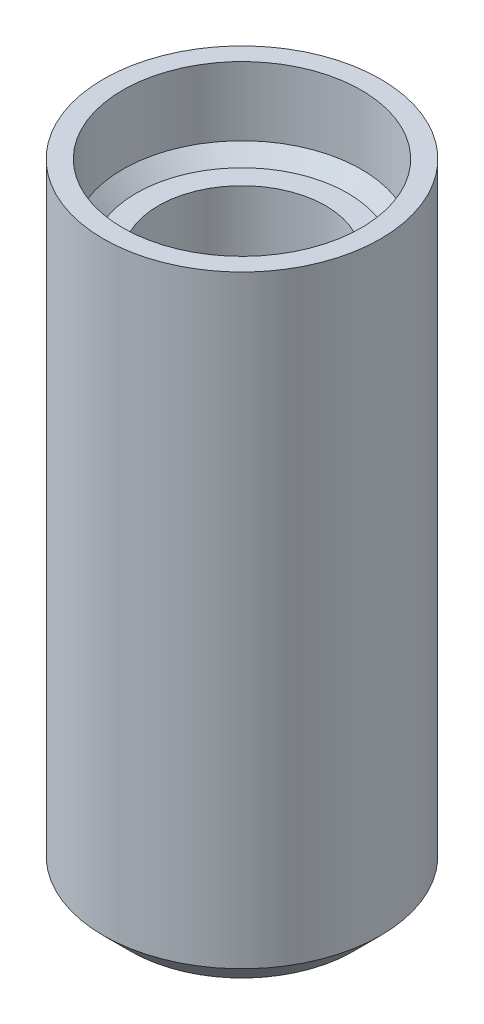
from build123d import *

# Parameters (mm, degrees)
SKETCH1_R           = 5.05
BOSS_EXTRUDE1_DEPTH = 20
SKETCH2_R           = 5.05
BOSS_EXTRUDE2_DEPTH = 2
SKETCH4_R           = 5.05
SKETCH4_R_2         = 4.35
BOSS_EXTRUDE3_DEPTH = 3
CHAMFER1_SIZE       = 1
CHAMFER2_SIZE       = 0.5
CUT_EXTRUDE1_DEPTH  = 0.4
BOSS_EXTRUDE4_DEPTH = 0.4


with BuildPart() as part:
    # Sketch1 → Boss-Extrude1 (new body)
    with BuildSketch(Plane(origin=(0, 0, 0), x_dir=(1, 0, 0), z_dir=(0, 1, 0))):
        Circle(SKETCH1_R)
        with BuildLine():
            Line((2.565151068, -1.65), (-2.565151068, -1.65))
            ThreePointArc((-2.565151068, -1.65), (0, 3.05), (2.565151068, -1.65))
        make_face(mode=Mode.SUBTRACT)
    extrude(amount=BOSS_EXTRUDE1_DEPTH)

    # Sketch2 → Boss-Extrude2 (add)
    with BuildSketch(Plane.XZ):
        Circle(SKETCH2_R)
    extrude(amount=-BOSS_EXTRUDE2_DEPTH)

    # Sketch4 → Boss-Extrude3 (add)
    with BuildSketch(Plane(origin=(0, 20, 0), x_dir=(1, 0, 0), z_dir=(0, 1, 0))):
        Circle(SKETCH4_R)
        Circle(SKETCH4_R_2, mode=Mode.SUBTRACT)
    extrude(amount=BOSS_EXTRUDE3_DEPTH)

    # Chamfer1
    chamfer1_edges = [part.edges().sort_by_distance(p)[0] for p in [
        (-5.05, 0, 0),
    ]]
    chamfer(chamfer1_edges, length=CHAMFER1_SIZE)

    # Chamfer2
    chamfer2_edges = [part.edges().sort_by_distance(p)[0] for p in [
        (-4.35, 20, 0),
    ]]
    chamfer(chamfer2_edges, length=CHAMFER2_SIZE)

    # Sketch5 → Cut-Extrude1 (cut)
    with BuildSketch(Plane.XZ):
        with BuildLine():
            add(Edge.make_bspline(
                [(1.567944017, 0.192921702), (1.567103463, 0.108565787), (1.565463932, -0.055973519), (1.549247691, -0.296621434), (1.522305793, -0.524534963), (1.486045945, -0.739816248), (1.43789322, -0.94151744), (1.374732908, -1.128195766), (1.298972887, -1.299878577), (1.210234813, -1.45621372), (1.106200607, -1.595338144), (0.989027334, -1.718882792), (0.85541095, -1.82326619), (0.707974056, -1.911459997), (0.544618259, -1.980846605), (0.364036396, -2.029758899), (0.166581818, -2.058442163), (0.029096593, -2.062104092), (-0.0419985, -2.063997715)],
                knots=[0, 0, 0, 0, 1.280142505, 2.496964928, 3.658445283, 4.762089533, 5.808699902, 6.802158264, 7.748814871, 8.653008089, 9.524146816, 10.379274413, 11.229404425, 12.089188086, 12.979964829, 13.913938538, 14.921275101, 16, 16, 16, 16], degree=3))
            add(Edge.make_bspline(
                [(-0.0419985, -2.063997715), (-0.114085658, -2.062061431), (-0.25217864, -2.05835221), (-0.449985974, -2.030813074), (-0.628118332, -1.983161468), (-0.787614595, -1.91659627), (-0.929750651, -1.832021476), (-1.054014515, -1.728205005), (-1.166223856, -1.610806373), (-1.259802448, -1.473792655), (-1.340149019, -1.321620028), (-1.406392893, -1.153626181), (-1.462209271, -0.970619118), (-1.501652878, -0.771428752), (-1.530893692, -0.557930049), (-1.552900083, -0.331105069), (-1.566011318, -0.090558156), (-1.567288008, 0.074242538), (-1.567944017, 0.158922916)],
                knots=[0, 0, 0, 0, 1.116564975, 2.138935591, 3.085931557, 3.965362537, 4.808430945, 5.637530691, 6.466775146, 7.316224023, 8.198621357, 9.127780993, 10.109559384, 11.158728965, 12.269463774, 13.447127443, 14.688244517, 16, 16, 16, 16], degree=3))
            add(Edge.make_bspline(
                [(-1.567944017, 0.158922916), (-1.56727094, 0.242959484), (-1.565958022, 0.406883046), (-1.547398036, 0.646654941), (-1.523007328, 0.874561982), (-1.484863664, 1.090015475), (-1.435637119, 1.292183379), (-1.373223381, 1.47955795), (-1.296737874, 1.650978747), (-1.207898153, 1.807115713), (-1.104587297, 1.947471726), (-0.98597514, 2.070365378), (-0.85247465, 2.175171039), (-0.704955811, 2.263283651), (-0.541625887, 2.332713568), (-0.361663301, 2.381358039), (-0.165271392, 2.41038651), (-0.028768775, 2.413979575), (0.0419985, 2.415842333)],
                knots=[0, 0, 0, 0, 1.275935792, 2.488868156, 3.650539398, 4.755790181, 5.809222936, 6.808140458, 7.750805295, 8.655602092, 9.531384403, 10.390594486, 11.241291987, 12.101649582, 12.993020947, 13.927618113, 14.925611662, 16, 16, 16, 16], degree=3))
            add(Edge.make_bspline(
                [(0.0419985, 2.415842333), (0.114116742, 2.414477102), (0.25266071, 2.411854403), (0.450369145, 2.381996557), (0.629787664, 2.336446676), (0.789415008, 2.268229736), (0.932246599, 2.183738709), (1.058666183, 2.081763133), (1.168735568, 1.962207144), (1.262973651, 1.825777095), (1.342954906, 1.673381215), (1.409963879, 1.505846105), (1.462541112, 1.32206188), (1.502782179, 1.123329255), (1.53216605, 0.909819278), (1.552535707, 0.682887301), (1.56611107, 0.442411219), (1.567321867, 0.277604947), (1.567944017, 0.192921702)],
                knots=[0, 0, 0, 0, 1.1154279, 2.142811628, 3.087698179, 3.973172265, 4.819981724, 5.64914424, 6.477969577, 7.326725871, 8.20840376, 9.136805822, 10.114848545, 11.163162705, 12.272991897, 13.449208879, 14.689314032, 16, 16, 16, 16], degree=3))
        make_face()
        with BuildLine():
            add(Edge.make_bspline(
                [(0.671976007, 0.147923309), (0.671761143, 0.197588193), (0.671345794, 0.293594494), (0.668808788, 0.433310834), (0.662146824, 0.563600217), (0.655896273, 0.685705832), (0.645645678, 0.799372722), (0.633701885, 0.905396977), (0.620258167, 1.00361133), (0.59765882, 1.119852962), (0.568329454, 1.249495616), (0.518981489, 1.383972273), (0.462364111, 1.495483821), (0.390154993, 1.580567825), (0.309089162, 1.64532417), (0.215543768, 1.685097937), (0.113546356, 1.708789827), (0.04214035, 1.710814416), (0.004999821, 1.711867468)],
                knots=[0, 0, 0, 0, 1.252656067, 2.421487074, 3.523945301, 4.542880805, 5.504947389, 6.401770782, 7.23401126, 8.00401156, 9.388497809, 10.580084833, 11.61067594, 12.523473101, 13.374357542, 14.202341007, 15.064980546, 16, 16, 16, 16], degree=3))
            add(Edge.make_bspline(
                [(0.004999821, 1.711867468), (-0.027108728, 1.710864236), (-0.088874053, 1.708934376), (-0.176959711, 1.69002996), (-0.257491776, 1.661921091), (-0.328204301, 1.61855612), (-0.391883608, 1.564673792), (-0.446390573, 1.497365618), (-0.495990703, 1.419828291), (-0.537600354, 1.33018996), (-0.57214802, 1.229054924), (-0.602202545, 1.116857945), (-0.625857574, 0.992508092), (-0.643327979, 0.856556385), (-0.656089252, 0.709073987), (-0.664593927, 0.549983621), (-0.670996715, 0.379299441), (-0.671642924, 0.261592524), (-0.671976007, 0.200921416)],
                knots=[0, 0, 0, 0, 0.830406459, 1.597403976, 2.323929485, 3.028688112, 3.73286484, 4.474568648, 5.262512747, 6.112128818, 7.026802286, 8.027809387, 9.118195914, 10.302553145, 11.576589742, 12.951469302, 14.428658737, 16, 16, 16, 16], degree=3))
            add(Edge.make_bspline(
                [(-0.671976007, 0.200921416), (-0.671693117, 0.127586061), (-0.671152907, -0.012455865), (-0.664379896, -0.212557586), (-0.652177413, -0.392922081), (-0.637219032, -0.554576304), (-0.615048197, -0.698390465), (-0.588432778, -0.826054575), (-0.556697247, -0.938463654), (-0.520366102, -1.036416278), (-0.477076212, -1.119805415), (-0.42795422, -1.18948205), (-0.373592358, -1.246955409), (-0.312417185, -1.290914567), (-0.244560244, -1.322168759), (-0.171328649, -1.343429439), (-0.092277059, -1.358574957), (-0.037409576, -1.359528904), (-0.008999679, -1.36002285)],
                knots=[0, 0, 0, 0, 1.85321902, 3.538925519, 5.058498589, 6.421342315, 7.640056482, 8.733733654, 9.714903156, 10.58939389, 11.369318339, 12.082176755, 12.737469836, 13.359260972, 13.973474606, 14.615698241, 15.283220796, 16, 16, 16, 16], degree=3))
            add(Edge.make_bspline(
                [(-0.008999679, -1.36002285), (0.032888173, -1.358409415), (0.112951194, -1.355325549), (0.225931657, -1.323402443), (0.324771216, -1.270609496), (0.408752445, -1.194316331), (0.480103664, -1.09828067), (0.536658452, -0.979922054), (0.582719263, -0.842729097), (0.619415786, -0.685336917), (0.645900941, -0.507435022), (0.661850394, -0.307994676), (0.670355892, -0.087146742), (0.671420014, 0.067251613), (0.671976007, 0.147923309)],
                knots=[0, 0, 0, 0, 0.812198358, 1.552408438, 2.25954763, 2.970620909, 3.738781613, 4.570097942, 5.508197261, 6.546623335, 7.706294858, 8.999891258, 10.432471252, 12, 12, 12, 12], degree=3))
        make_face(mode=Mode.SUBTRACT)
    extrude(amount=-CUT_EXTRUDE1_DEPTH, mode=Mode.SUBTRACT)


with BuildPart() as body_2:
    # Sketch5<2> → Boss-Extrude4 (new body)
    with BuildSketch(Plane.XZ):
        with BuildLine():
            add(Edge.make_bspline(
                [(1.567944017, 0.192921702), (1.567103463, 0.108565787), (1.565463932, -0.055973519), (1.549247691, -0.296621434), (1.522305793, -0.524534963), (1.486045945, -0.739816248), (1.43789322, -0.94151744), (1.374732908, -1.128195766), (1.298972887, -1.299878577), (1.210234813, -1.45621372), (1.106200607, -1.595338144), (0.989027334, -1.718882792), (0.85541095, -1.82326619), (0.707974056, -1.911459997), (0.544618259, -1.980846605), (0.364036396, -2.029758899), (0.166581818, -2.058442163), (0.029096593, -2.062104092), (-0.0419985, -2.063997715)],
                knots=[0, 0, 0, 0, 1.280142505, 2.496964928, 3.658445283, 4.762089533, 5.808699902, 6.802158264, 7.748814871, 8.653008089, 9.524146816, 10.379274413, 11.229404425, 12.089188086, 12.979964829, 13.913938538, 14.921275101, 16, 16, 16, 16], degree=3))
            add(Edge.make_bspline(
                [(-0.0419985, -2.063997715), (-0.114085658, -2.062061431), (-0.25217864, -2.05835221), (-0.449985974, -2.030813074), (-0.628118332, -1.983161468), (-0.787614595, -1.91659627), (-0.929750651, -1.832021476), (-1.054014515, -1.728205005), (-1.166223856, -1.610806373), (-1.259802448, -1.473792655), (-1.340149019, -1.321620028), (-1.406392893, -1.153626181), (-1.462209271, -0.970619118), (-1.501652878, -0.771428752), (-1.530893692, -0.557930049), (-1.552900083, -0.331105069), (-1.566011318, -0.090558156), (-1.567288008, 0.074242538), (-1.567944017, 0.158922916)],
                knots=[0, 0, 0, 0, 1.116564975, 2.138935591, 3.085931557, 3.965362537, 4.808430945, 5.637530691, 6.466775146, 7.316224023, 8.198621357, 9.127780993, 10.109559384, 11.158728965, 12.269463774, 13.447127443, 14.688244517, 16, 16, 16, 16], degree=3))
            add(Edge.make_bspline(
                [(-1.567944017, 0.158922916), (-1.56727094, 0.242959484), (-1.565958022, 0.406883046), (-1.547398036, 0.646654941), (-1.523007328, 0.874561982), (-1.484863664, 1.090015475), (-1.435637119, 1.292183379), (-1.373223381, 1.47955795), (-1.296737874, 1.650978747), (-1.207898153, 1.807115713), (-1.104587297, 1.947471726), (-0.98597514, 2.070365378), (-0.85247465, 2.175171039), (-0.704955811, 2.263283651), (-0.541625887, 2.332713568), (-0.361663301, 2.381358039), (-0.165271392, 2.41038651), (-0.028768775, 2.413979575), (0.0419985, 2.415842333)],
                knots=[0, 0, 0, 0, 1.275935792, 2.488868156, 3.650539398, 4.755790181, 5.809222936, 6.808140458, 7.750805295, 8.655602092, 9.531384403, 10.390594486, 11.241291987, 12.101649582, 12.993020947, 13.927618113, 14.925611662, 16, 16, 16, 16], degree=3))
            add(Edge.make_bspline(
                [(0.0419985, 2.415842333), (0.114116742, 2.414477102), (0.25266071, 2.411854403), (0.450369145, 2.381996557), (0.629787664, 2.336446676), (0.789415008, 2.268229736), (0.932246599, 2.183738709), (1.058666183, 2.081763133), (1.168735568, 1.962207144), (1.262973651, 1.825777095), (1.342954906, 1.673381215), (1.409963879, 1.505846105), (1.462541112, 1.32206188), (1.502782179, 1.123329255), (1.53216605, 0.909819278), (1.552535707, 0.682887301), (1.56611107, 0.442411219), (1.567321867, 0.277604947), (1.567944017, 0.192921702)],
                knots=[0, 0, 0, 0, 1.1154279, 2.142811628, 3.087698179, 3.973172265, 4.819981724, 5.64914424, 6.477969577, 7.326725871, 8.20840376, 9.136805822, 10.114848545, 11.163162705, 12.272991897, 13.449208879, 14.689314032, 16, 16, 16, 16], degree=3))
        make_face()
        with BuildLine():
            add(Edge.make_bspline(
                [(0.671976007, 0.147923309), (0.671761143, 0.197588193), (0.671345794, 0.293594494), (0.668808788, 0.433310834), (0.662146824, 0.563600217), (0.655896273, 0.685705832), (0.645645678, 0.799372722), (0.633701885, 0.905396977), (0.620258167, 1.00361133), (0.59765882, 1.119852962), (0.568329454, 1.249495616), (0.518981489, 1.383972273), (0.462364111, 1.495483821), (0.390154993, 1.580567825), (0.309089162, 1.64532417), (0.215543768, 1.685097937), (0.113546356, 1.708789827), (0.04214035, 1.710814416), (0.004999821, 1.711867468)],
                knots=[0, 0, 0, 0, 1.252656067, 2.421487074, 3.523945301, 4.542880805, 5.504947389, 6.401770782, 7.23401126, 8.00401156, 9.388497809, 10.580084833, 11.61067594, 12.523473101, 13.374357542, 14.202341007, 15.064980546, 16, 16, 16, 16], degree=3))
            add(Edge.make_bspline(
                [(0.004999821, 1.711867468), (-0.027108728, 1.710864236), (-0.088874053, 1.708934376), (-0.176959711, 1.69002996), (-0.257491776, 1.661921091), (-0.328204301, 1.61855612), (-0.391883608, 1.564673792), (-0.446390573, 1.497365618), (-0.495990703, 1.419828291), (-0.537600354, 1.33018996), (-0.57214802, 1.229054924), (-0.602202545, 1.116857945), (-0.625857574, 0.992508092), (-0.643327979, 0.856556385), (-0.656089252, 0.709073987), (-0.664593927, 0.549983621), (-0.670996715, 0.379299441), (-0.671642924, 0.261592524), (-0.671976007, 0.200921416)],
                knots=[0, 0, 0, 0, 0.830406459, 1.597403976, 2.323929485, 3.028688112, 3.73286484, 4.474568648, 5.262512747, 6.112128818, 7.026802286, 8.027809387, 9.118195914, 10.302553145, 11.576589742, 12.951469302, 14.428658737, 16, 16, 16, 16], degree=3))
            add(Edge.make_bspline(
                [(-0.671976007, 0.200921416), (-0.671693117, 0.127586061), (-0.671152907, -0.012455865), (-0.664379896, -0.212557586), (-0.652177413, -0.392922081), (-0.637219032, -0.554576304), (-0.615048197, -0.698390465), (-0.588432778, -0.826054575), (-0.556697247, -0.938463654), (-0.520366102, -1.036416278), (-0.477076212, -1.119805415), (-0.42795422, -1.18948205), (-0.373592358, -1.246955409), (-0.312417185, -1.290914567), (-0.244560244, -1.322168759), (-0.171328649, -1.343429439), (-0.092277059, -1.358574957), (-0.037409576, -1.359528904), (-0.008999679, -1.36002285)],
                knots=[0, 0, 0, 0, 1.85321902, 3.538925519, 5.058498589, 6.421342315, 7.640056482, 8.733733654, 9.714903156, 10.58939389, 11.369318339, 12.082176755, 12.737469836, 13.359260972, 13.973474606, 14.615698241, 15.283220796, 16, 16, 16, 16], degree=3))
            add(Edge.make_bspline(
                [(-0.008999679, -1.36002285), (0.032888173, -1.358409415), (0.112951194, -1.355325549), (0.225931657, -1.323402443), (0.324771216, -1.270609496), (0.408752445, -1.194316331), (0.480103664, -1.09828067), (0.536658452, -0.979922054), (0.582719263, -0.842729097), (0.619415786, -0.685336917), (0.645900941, -0.507435022), (0.661850394, -0.307994676), (0.670355892, -0.087146742), (0.671420014, 0.067251613), (0.671976007, 0.147923309)],
                knots=[0, 0, 0, 0, 0.812198358, 1.552408438, 2.25954763, 2.970620909, 3.738781613, 4.570097942, 5.508197261, 6.546623335, 7.706294858, 8.999891258, 10.432471252, 12, 12, 12, 12], degree=3))
        make_face(mode=Mode.SUBTRACT)
    extrude(amount=-BOSS_EXTRUDE4_DEPTH)


solid = Compound([part.part, body_2.part])
